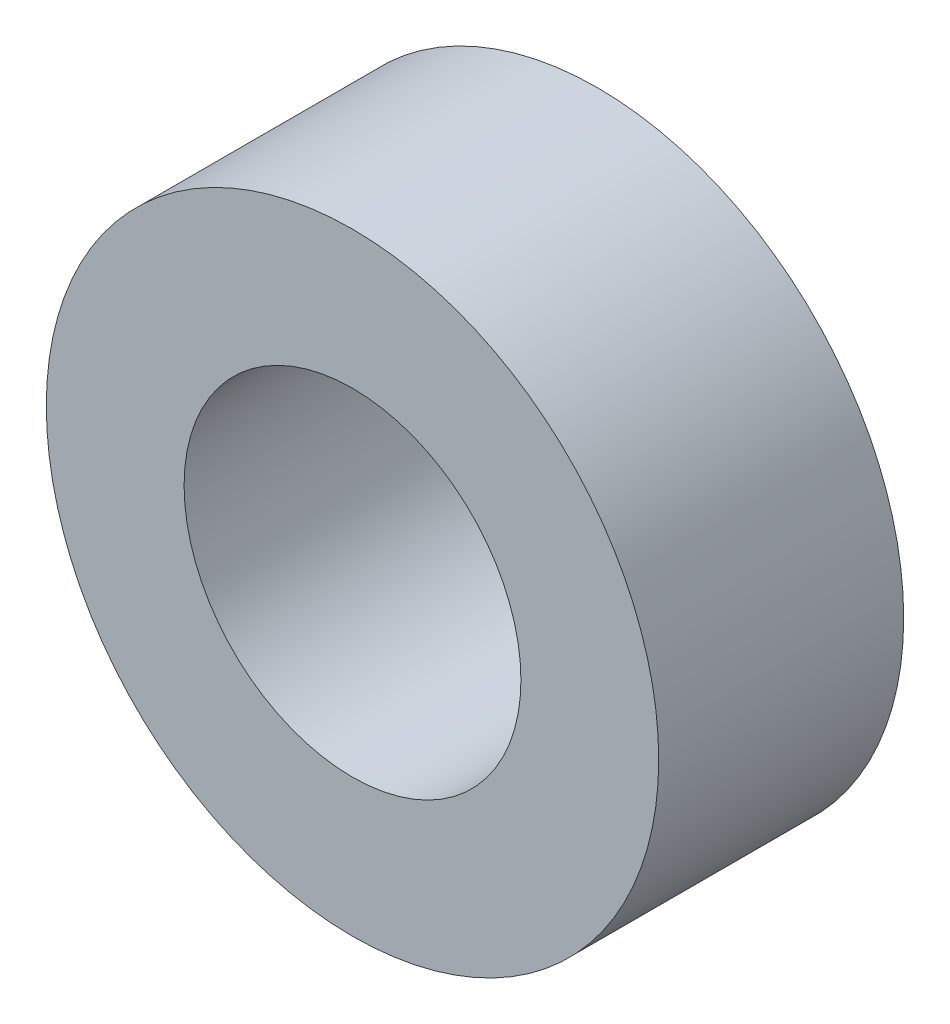
from build123d import *

# Parameters (mm, degrees)
SKETCH1_R           = 5
SKETCH1_R_2         = 2.75
BOSS_EXTRUDE1_DEPTH = 4


with BuildPart() as part:
    # Sketch1 → Boss-Extrude1 (new body)
    with BuildSketch(Plane.XY):
        Circle(SKETCH1_R)
        Circle(SKETCH1_R_2, mode=Mode.SUBTRACT)
    extrude(amount=BOSS_EXTRUDE1_DEPTH)


solid = part.part
